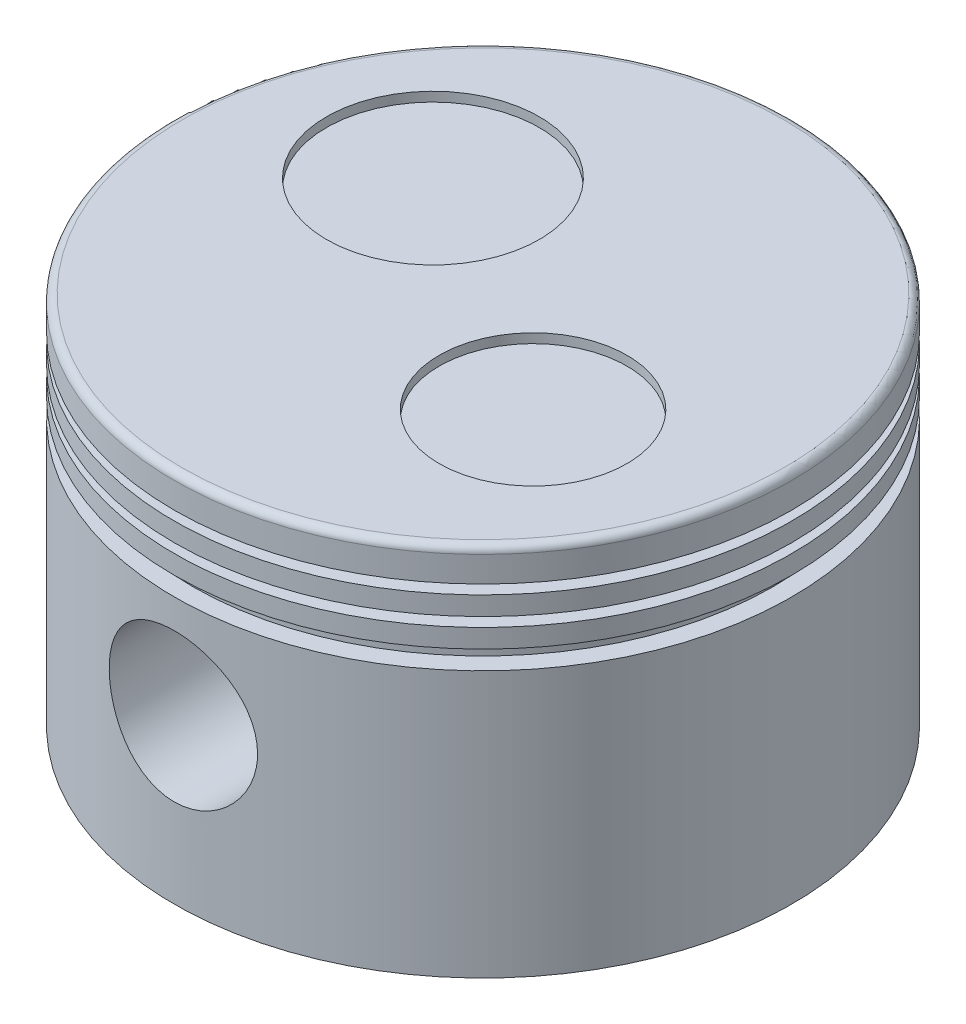
from build123d import *

# Parameters (mm, degrees)
PIN_START            = 13
PIN_BOSS_FRONT_DEPTH = 31.5
PIN_START_2          = -44.5
PIN_BOSS_REAR_DEPTH  = 31.5
PIN_BORE_DEPTH       = 78.481739955
PIN_BORE_DEPTH_BACK  = 78.481739955
SKETCH4_R            = 11.85
SKETCH5_W            = 4.1
SKETCH5_H            = 1.5
SKETCH5_H_2          = 3
SKETCH6_R            = 17
SKETCH6_R_2          = 15
VALVE_RELIEFS_DEPTH  = 1.5


with BuildPart() as part:
    # Sketch1 → Piston Body (revolve)
    with BuildSketch(Plane.XY):
        with BuildLine():
            Line((0, 33.8), (48.1, 33.8))
            ThreePointArc((48.1, 33.8), (48.948528137, 33.448528137), (49.3, 32.6))
            Line((49.3, 32.6), (49.3, -26))
            Line((49.3, -26), (44.3, -26))
            Line((44.3, -26), (44.3, 19))
            Line((44.3, 19), (0, 19))
            Line((0, 19), (0, 33.8))
        make_face()
    revolve(axis=Axis((0, -60, 0), (0, 1, 0)))

    # Sketch2 → Pin Boss Front (add)
    with BuildSketch(Plane.XY.offset(PIN_START)):
        with BuildLine():
            Line((-17, 19.5), (-17, -1.7))
            ThreePointArc((-17, -1.7), (-12.518733752, -12.518733752), (-1.7, -17))
            Line((-1.7, -17), (1.7, -17))
            ThreePointArc((1.7, -17), (12.518733752, -12.518733752), (17, -1.7))
            Line((17, -1.7), (17, 19.5))
            Line((17, 19.5), (-17, 19.5))
        make_face()
    extrude(amount=PIN_BOSS_FRONT_DEPTH)

    # Sketch3 → Pin Boss Rear (add)
    with BuildSketch(Plane.XY.offset(PIN_START_2)):
        with BuildLine():
            Line((-17, 19.5), (-17, -1.7))
            ThreePointArc((-17, -1.7), (-12.518733752, -12.518733752), (-1.7, -17))
            Line((-1.7, -17), (1.7, -17))
            ThreePointArc((1.7, -17), (12.518733752, -12.518733752), (17, -1.7))
            Line((17, -1.7), (17, 19.5))
            Line((17, 19.5), (-17, 19.5))
        make_face()
    extrude(amount=PIN_BOSS_REAR_DEPTH)

    # Sketch4 → Pin Bore (cut, two sides: drawn at the far end of the back side and taken through both)
    with BuildSketch(Plane.XY.offset(-PIN_BORE_DEPTH_BACK)):
        Circle(SKETCH4_R)
    extrude(amount=PIN_BORE_DEPTH + PIN_BORE_DEPTH_BACK, mode=Mode.SUBTRACT)

    # Sketch5 → Ring Grooves (revolve, cut)
    with BuildSketch(Plane.XY):
        with Locations((48.45, 27.75)):
            Rectangle(SKETCH5_W, SKETCH5_H)
        with Locations((48.45, 23.25)):
            Rectangle(SKETCH5_W, SKETCH5_H)
        with Locations((48.45, 18)):
            Rectangle(SKETCH5_W, SKETCH5_H_2)
    revolve(axis=Axis((0, -60, 0), (0, 1, 0)), mode=Mode.SUBTRACT)

    # Sketch6 → Valve Reliefs (cut)
    with BuildSketch(Plane(origin=(0, 33.8, 0), x_dir=(1, 0, 0), z_dir=(0, 1, 0))):
        with Locations((-20, 12)):
            Circle(SKETCH6_R)
        with Locations((20, -12)):
            Circle(SKETCH6_R_2)
    extrude(amount=-VALVE_RELIEFS_DEPTH, mode=Mode.SUBTRACT)


solid = part.part
